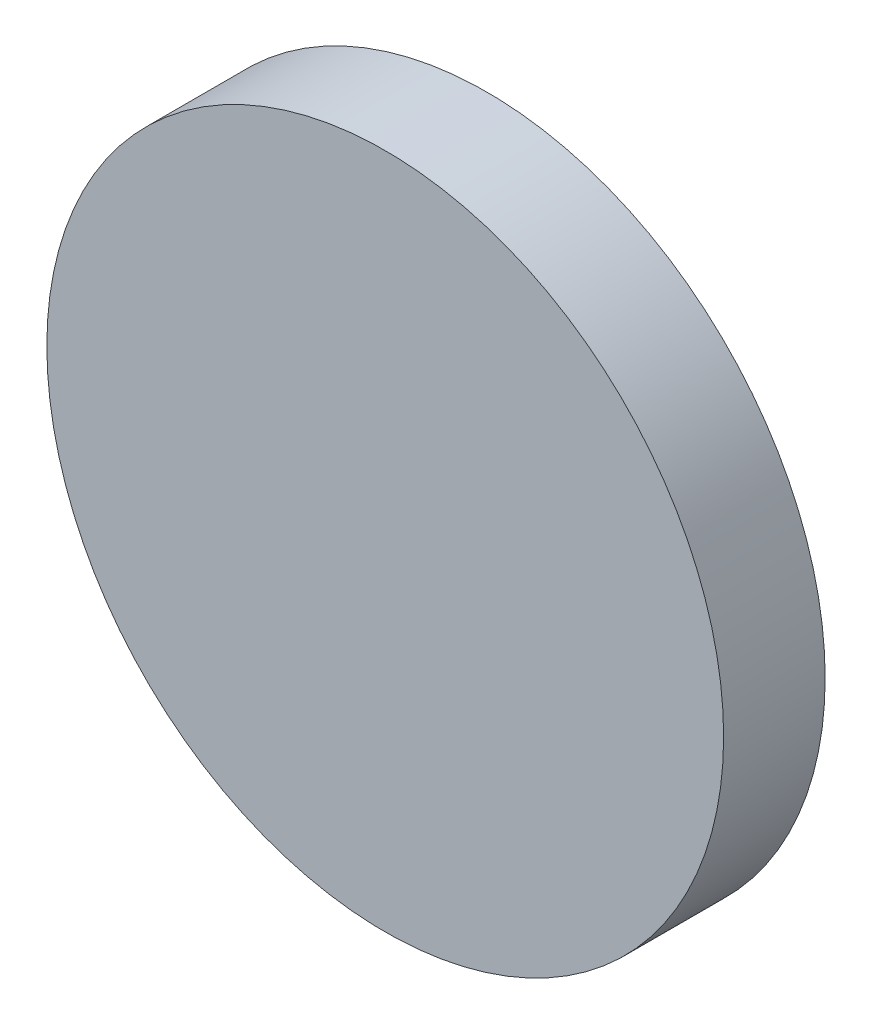
from build123d import *

# Parameters (mm, degrees)
ESQUISSE1_R        = 2
BOSS_EXTRU_1_DEPTH = 0.6


with BuildPart() as part:
    # Esquisse1 → Boss.-Extru.1 (new body)
    with BuildSketch(Plane.XY):
        Circle(ESQUISSE1_R)
    extrude(amount=BOSS_EXTRU_1_DEPTH)


solid = part.part
